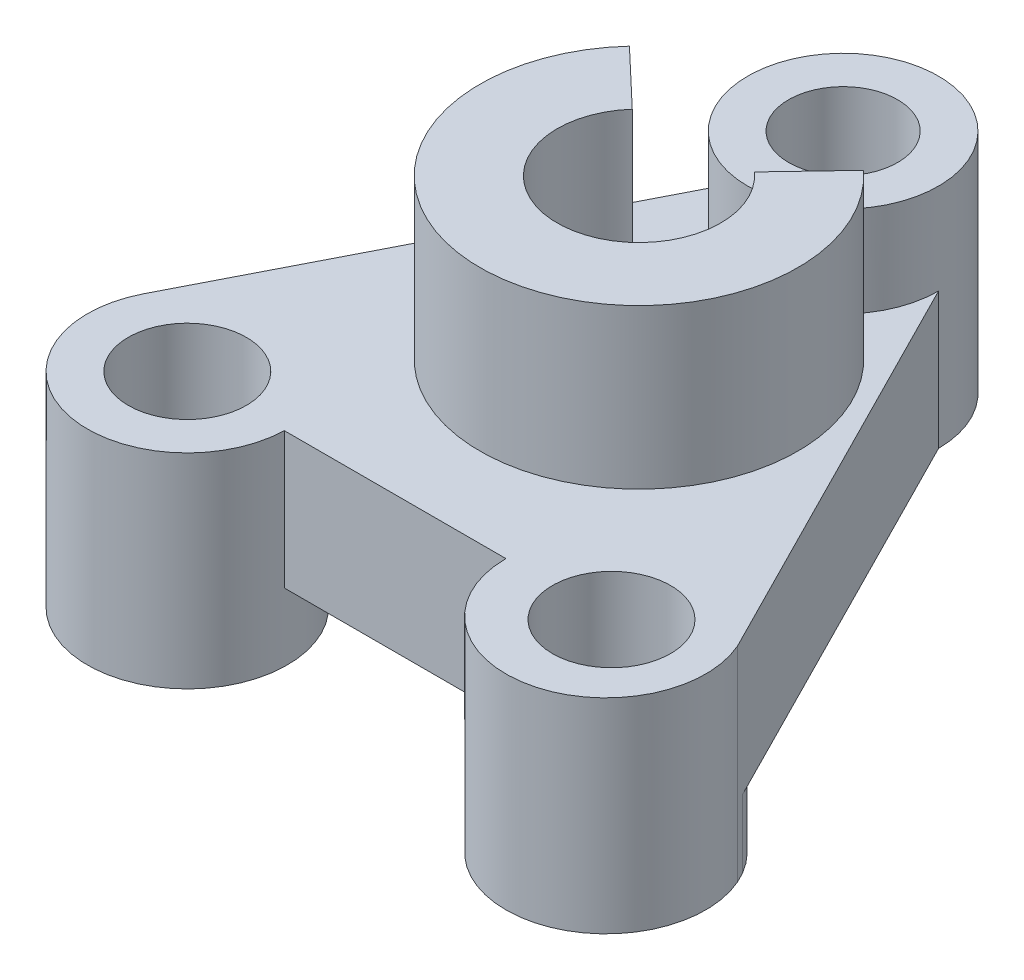
from build123d import *

# Parameters (mm, degrees)
SKETCH2_R           = 13
BOSS_EXTRUDE1_DEPTH = 30
SKETCH3_R           = 21
SKETCH3_R_2         = 12
BOSS_EXTRUDE3_DEPTH = 30
BOSS_EXTRUDE4_START = 20
SKETCH4_R           = 21
BOSS_EXTRUDE4_DEPTH = 20
CUT_EXTRUDE3_START  = 20
SKETCH6_R           = 12
CUT_EXTRUDE3_DEPTH  = 20
BOSS_EXTRUDE5_DEPTH = 35
SKETCH8_R           = 13
BOSS_EXTRUDE6_DEPTH = 15


with BuildPart() as part:
    # Sketch2 → Boss-Extrude1 (new body)
    with BuildSketch(Plane(origin=(0, 0, 0), x_dir=(1, 0, 0), z_dir=(0, 1, 0))):
        with BuildLine():
            Line((-63.748151168, 83.4945297), (-108.720702631, -4.492807031))
            ThreePointArc((-108.720702631, -4.492807031), (-94.582688401, -35.819358768), (-67.140057524, -15.127855665))
            Line((-67.140057524, -15.127855665), (-18.356244812, -15.127855665))
            ThreePointArc((-18.356244812, -15.127855665), (8.155744942, -36.660202227), (23.79302323, -6.295698659))
            Line((23.79302323, -6.295698659), (22.673576153, -4.088566102))
            Line((22.673576153, -4.088566102), (-21.748151168, 83.4945297))
            ThreePointArc((-21.748151168, 83.4945297), (-42.748151168, 62.4945297), (-63.748151168, 83.4945297))
        make_face()
        with Locations(Location((-89.131252045, -14.5054703, 0), (0, 0, 270))):
            Circle(SKETCH2_R, mode=Mode.SUBTRACT)
        with Locations(Location((4.884095697, -15.127855665, 0), (0, 0, 270))):
            Circle(SKETCH2_R, mode=Mode.SUBTRACT)
    extrude(amount=-BOSS_EXTRUDE1_DEPTH)

    # Sketch3 → Boss-Extrude3 (add)
    with BuildSketch(Plane(origin=(0, 0, 0), x_dir=(1, 0, 0), z_dir=(0, 1, 0))):
        with Locations((-42.748151168, 83.4945297)):
            Circle(SKETCH3_R)
        with Locations(Location((-42.748151168, 83.4945297, 0), (0, 0, 270))):
            Circle(SKETCH3_R_2, mode=Mode.SUBTRACT)
    extrude(amount=-BOSS_EXTRUDE3_DEPTH)

    # Sketch4 → Boss-Extrude4 (add)
    with BuildSketch(Plane(origin=(0, 0, 0), x_dir=(1, 0, 0), z_dir=(0, 1, 0)).offset(BOSS_EXTRUDE4_START)):
        with Locations(Location((-42.748151168, 83.4945297, 0), (0, 0, 270))):
            Circle(SKETCH4_R)
    extrude(amount=-BOSS_EXTRUDE4_DEPTH)

    # Sketch6 → Cut-Extrude3 (cut)
    with BuildSketch(Plane(origin=(0, 0, 0), x_dir=(1, 0, 0), z_dir=(0, 1, 0)).offset(CUT_EXTRUDE3_START)):
        with Locations(Location((-42.748151168, 83.4945297, 0), (0, 0, 270))):
            Circle(SKETCH6_R)
    extrude(amount=-CUT_EXTRUDE3_DEPTH, mode=Mode.SUBTRACT)

    # Sketch7 → Boss-Extrude5 (add)
    with BuildSketch(Plane(origin=(0, 0, 0), x_dir=(1, 0, 0), z_dir=(0, 1, 0))):
        with BuildLine():
            Line((-55.137118112, 49.462443333), (-67.471148686, 61.168135895))
            ThreePointArc((-67.471148686, 61.168135895), (-40.20329361, 2.526208117), (-18.018474049, 63.273598143))
            Line((-18.018474049, 63.273598143), (-29.724166611, 50.939567569))
            ThreePointArc((-29.724166611, 50.939567569), (-40.647595679, 19.524859364), (-55.137118112, 49.462443333))
        make_face()
    extrude(amount=BOSS_EXTRUDE5_DEPTH)

    # Sketch8 → Boss-Extrude6 (add)
    # profile 1 of 2: a face of its own
    with BuildSketch(Plane.XZ.offset(30)):
        with BuildLine():
            ThreePointArc((25.643755188, 15.127855665), (3.643755188, 37.127855665), (-18.356244812, 15.127855665))
            ThreePointArc((-18.356244812, 15.127855665), (-2.072184751, -6.116626692), (22.673576153, 4.088566102))
            Line((22.673576153, 4.088566102), (23.79302323, 6.295698659))
            ThreePointArc((23.79302323, 6.295698659), (25.17610175, 10.615865911), (25.643755188, 15.127855665))
        make_face()
        with Locations(Location((4.884095697, 15.127855665, 0), (0, 0, 90))):
            Circle(SKETCH8_R, mode=Mode.SUBTRACT)
    # profile 2 of 2: a face of its own
    with BuildSketch(Plane.XZ.offset(30)):
        with BuildLine():
            ThreePointArc((-67.131252045, 14.5054703), (-67.133453525, 14.816694125), (-67.140057524, 15.127855665))
            ThreePointArc((-67.140057524, 15.127855665), (-94.582688401, 35.819358768), (-108.720702631, 4.492807031))
            ThreePointArc((-108.720702631, 4.492807031), (-83.981878922, -6.883404296), (-67.131252045, 14.5054703))
        make_face()
        with Locations(Location((-89.131252045, 14.5054703, 0), (0, 0, 90))):
            Circle(SKETCH8_R, mode=Mode.SUBTRACT)
    extrude(amount=BOSS_EXTRUDE6_DEPTH)


solid = part.part
